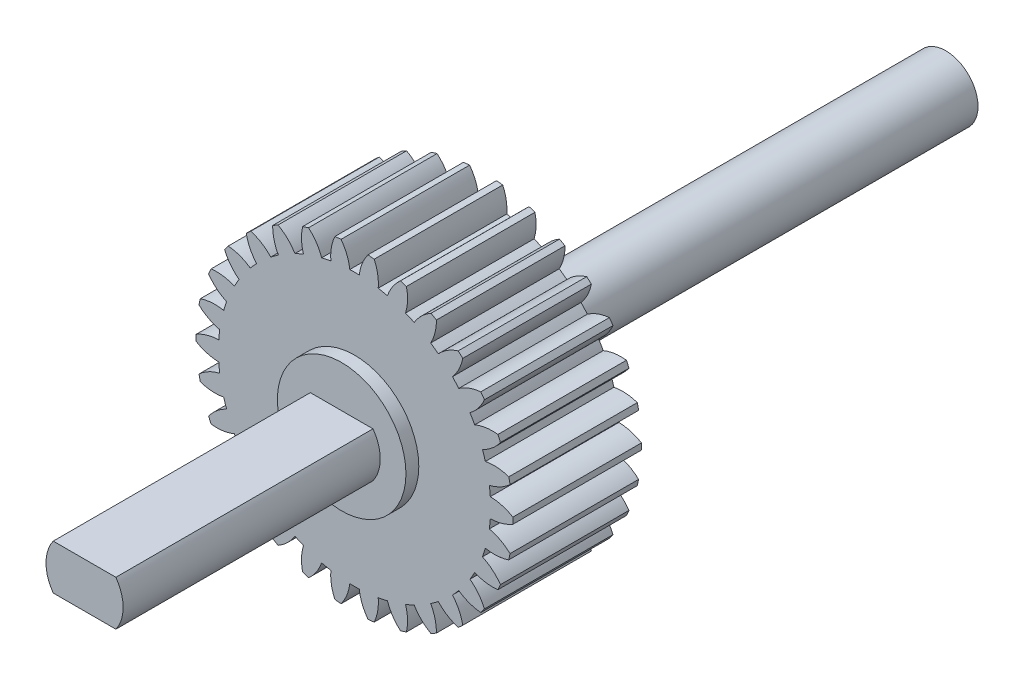
from build123d import *

# Parameters (mm, degrees)
SKETCH_1_R               = 12.32
EXTRUDE_1_DEPTH          = 5
PATTERN_CIRCULAR_1_COUNT = 30
SKETCH_6_R               = 5
EXTRUDE_6_DEPTH          = 1
EXTRUDE_7_DEPTH          = 20
SKETCH_9_R               = 2.5
EXTRUDE_8_DEPTH          = 36


with BuildPart() as part:
    # Эскиз1 → Бобышка-Вытянуть1 (new, symmetric)
    with BuildSketch(Plane.XY):
        Circle(SKETCH_1_R)
    extrude(amount=EXTRUDE_1_DEPTH, both=True)

    # Эскиз5 for Вырез-По сечениям1 → Вырез-По сечениям1 section 0
    with BuildSketch(Plane.XY.offset(-5)):
        with BuildLine():
            # circular arc as an exact rational Bezier (weights 1, cos(half-angle), 1)
            Bezier((-1.458691761, 12.736742847), (-0.522105639, 11.856767026), (-0.365824723, 10.581178031), weights=[1, 0.940287899, 1])
            Bezier((-0.365824723, 10.581178031), (0, 10.593825746), (0.365824723, 10.581178031), weights=[1, 0.999402884, 1])
            Bezier((0.365824723, 10.581178031), (0.522105639, 11.856767026), (1.458691761, 12.736742847), weights=[1, 0.940287899, 1])
            Bezier((1.458691761, 12.736742847), (0, 12.903801386), (-1.458691761, 12.736742847), weights=[1, 0.993505682, 1])
        make_face()
    # Эскиз2 for Вырез-По сечениям1 → Вырез-По сечениям1 section 1
    with BuildSketch(Plane.XY.offset(5)):
        with BuildLine():
            Bezier((-1.458691761, 12.736742847), (-0.522105639, 11.856767026), (-0.365824723, 10.581178031), weights=[1, 0.940287899, 1])
            Bezier((-0.365824723, 10.581178031), (0, 10.593825746), (0.365824723, 10.581178031), weights=[1, 0.999402884, 1])
            Bezier((0.365824723, 10.581178031), (0.522105639, 11.856767026), (1.458691761, 12.736742847), weights=[1, 0.940287899, 1])
            Bezier((1.458691761, 12.736742847), (0, 12.903801386), (-1.458691761, 12.736742847), weights=[1, 0.993505682, 1])
        make_face()
    loft_1 = loft(mode=Mode.SUBTRACT)

    # Круговой массив1: Вырез-По сечениям1 ×30 about axis
    pattern_circular_1_axis = Axis((0, 0, 0), (0, 0, 1))
    for i in range(1, PATTERN_CIRCULAR_1_COUNT):
        add(loft_1.rotate(pattern_circular_1_axis, i * 360 / PATTERN_CIRCULAR_1_COUNT), mode=Mode.SUBTRACT)

    # Эскиз6 → Бобышка-Вытянуть6 (add)
    with BuildSketch(Plane.XY.offset(5)):
        Circle(SKETCH_6_R)
    extrude(amount=EXTRUDE_6_DEPTH)

    # Эскиз10 → Бобышка-Вытянуть7 (add)
    with BuildSketch(Plane.XY.offset(6)):
        with BuildLine():
            Line((2.436698586, 1.75), (-2.436698586, 1.75))
            ThreePointArc((-2.436698586, 1.75), (-3, 0), (-2.436698586, -1.75))
            Line((-2.436698586, -1.75), (2.436698586, -1.75))
            ThreePointArc((2.436698586, -1.75), (2.855704445, -0.919212772), (3, 0))
            ThreePointArc((3, 0), (2.855704445, 0.919212772), (2.436698586, 1.75))
        make_face()
    extrude(amount=EXTRUDE_7_DEPTH)

    # Эскиз9 → Бобышка-Вытянуть8 (add)
    with BuildSketch(Plane(origin=(0, 0, -5), x_dir=(-1, 0, 0), z_dir=(0, 0, -1))):
        with Locations(Location((0, 0, 0), (0, 0, 180))):
            Circle(SKETCH_9_R)
    extrude(amount=EXTRUDE_8_DEPTH)


solid = part.part
